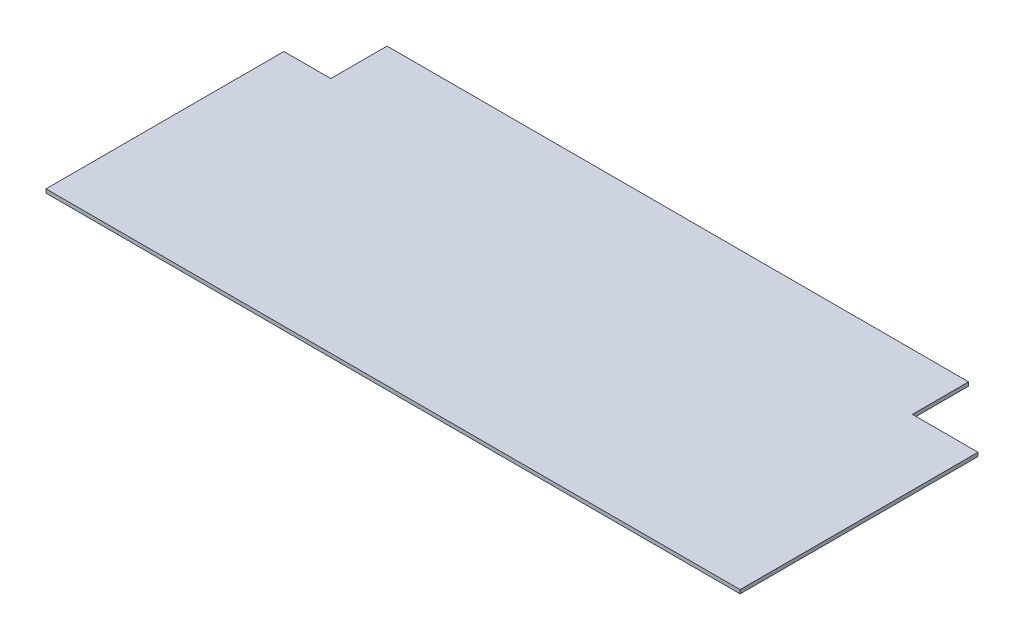
from build123d import *

# Parameters (mm, degrees)
BOSS_EXTRUDE1_DEPTH = 2.54


with BuildPart() as part:
    # Sketch1 → Boss-Extrude1 (new body)
    with BuildSketch(Plane(origin=(0, 0, 0), x_dir=(1, 0, 0), z_dir=(0, 1, 0))):
        Polygon((-124.27279724, 128.157824305), (-124.27279724, -32.878175695), (345.628602808, -32.878175695), (345.628602808, 128.157824305), (301.178602808, 128.157824305), (301.178602808, 166.257824305), (-92.52279724, 166.257824305), (-92.52279724, 128.157824305), align=None)
    extrude(amount=BOSS_EXTRUDE1_DEPTH)


solid = part.part
